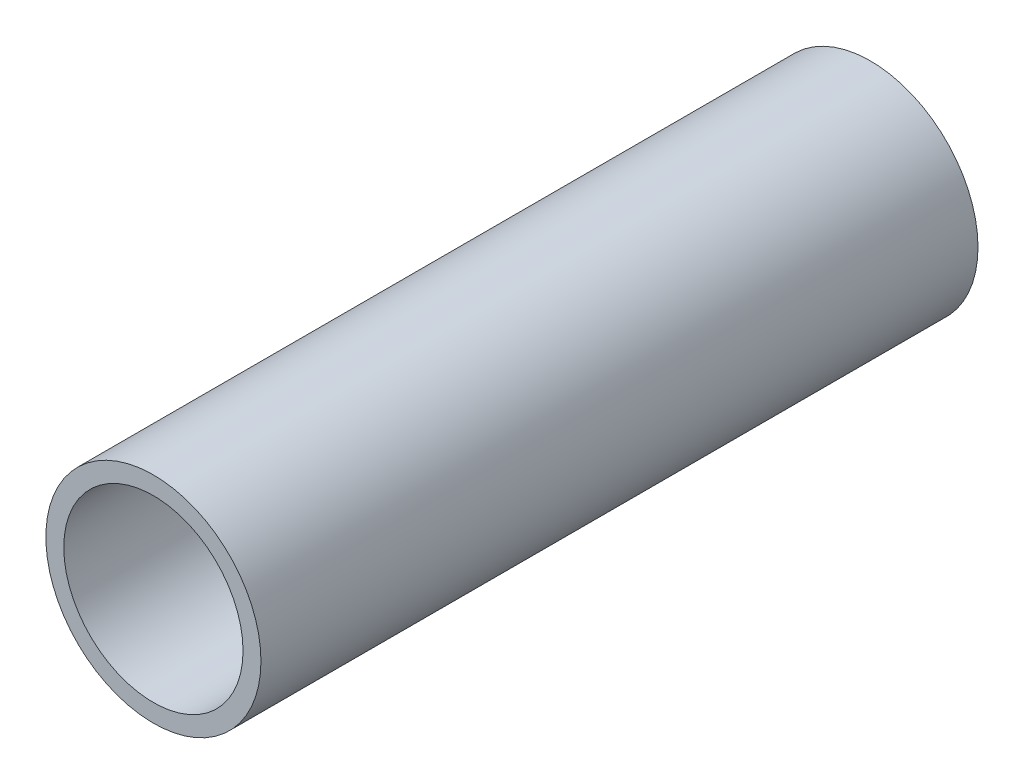
from build123d import *

# Parameters (mm, degrees)
SKETCH_1_R      = 6
SKETCH_1_R_2    = 5
EXTRUDE_1_DEPTH = 40


with BuildPart() as part:
    # 草图1 → 凸台-拉伸1 (new body)
    with BuildSketch(Plane.XY):
        Circle(SKETCH_1_R)
        Circle(SKETCH_1_R_2, mode=Mode.SUBTRACT)
    extrude(amount=EXTRUDE_1_DEPTH)


solid = part.part
